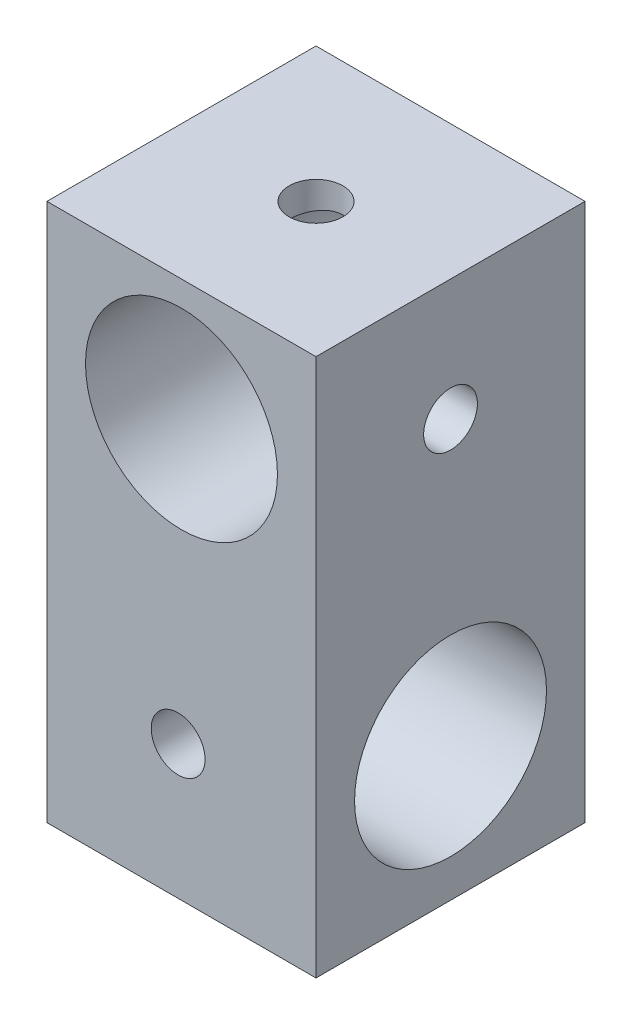
from build123d import *

# Parameters (mm, degrees)
SKETCH_1_W          = 15
SKETCH_1_H          = 30
EXTRUDE_1_DEPTH     = 15
SKETCH_2_R          = 5.35
CUT_EXTRUDE_1_DEPTH = 15
SKETCH_4_R          = 5.35
CUT_EXTRUDE_2_DEPTH = 15
SKETCH_5_R          = 1.5
CUT_EXTRUDE_3_DEPTH = 20
SKETCH_7_R          = 1.5
CUT_EXTRUDE_4_DEPTH = 20
SKETCH_8_R          = 1.5
CUT_EXTRUDE_5_DEPTH = 50


with BuildPart() as part:
    # 草图1 → 凸台-拉伸1 (new body)
    with BuildSketch(Plane(origin=(0, 0, 0), x_dir=(0, 0, -1), z_dir=(1, 0, 0))):
        Rectangle(SKETCH_1_W, SKETCH_1_H)
    extrude(amount=EXTRUDE_1_DEPTH)

    # 草图2 → 切除-拉伸1 (cut)
    with BuildSketch(Plane(origin=(15, 0, 0), x_dir=(0, 0, -1), z_dir=(1, 0, 0))):
        with Locations((0, -7.537865607)):
            Circle(SKETCH_2_R)
    extrude(amount=-CUT_EXTRUDE_1_DEPTH, mode=Mode.SUBTRACT)

    # 草图4 → 切除-拉伸2 (cut)
    with BuildSketch(Plane.XY.offset(7.5)):
        with Locations((7.5, 8.242569868)):
            Circle(SKETCH_4_R)
    extrude(amount=-CUT_EXTRUDE_2_DEPTH, mode=Mode.SUBTRACT)

    # 草图5 → 切除-拉伸3 (cut)
    with BuildSketch(Plane.XY.offset(7.5)):
        with Locations((7.314343795, -7.54)):
            Circle(SKETCH_5_R)
    extrude(amount=-CUT_EXTRUDE_3_DEPTH, mode=Mode.SUBTRACT)

    # 草图7 → 切除-拉伸4 (cut)
    with BuildSketch(Plane(origin=(15, 0, 0), x_dir=(0, 0, -1), z_dir=(1, 0, 0))):
        with Locations((0, 8.24)):
            Circle(SKETCH_7_R)
    extrude(amount=-CUT_EXTRUDE_4_DEPTH, mode=Mode.SUBTRACT)

    # 草图8 → 切除-拉伸5 (cut)
    with BuildSketch(Plane.XZ.offset(15)):
        with Locations(Location((7.5, 0, 0), (0, 0, 270))):
            Circle(SKETCH_8_R)
    extrude(amount=-CUT_EXTRUDE_5_DEPTH, mode=Mode.SUBTRACT)


solid = part.part
